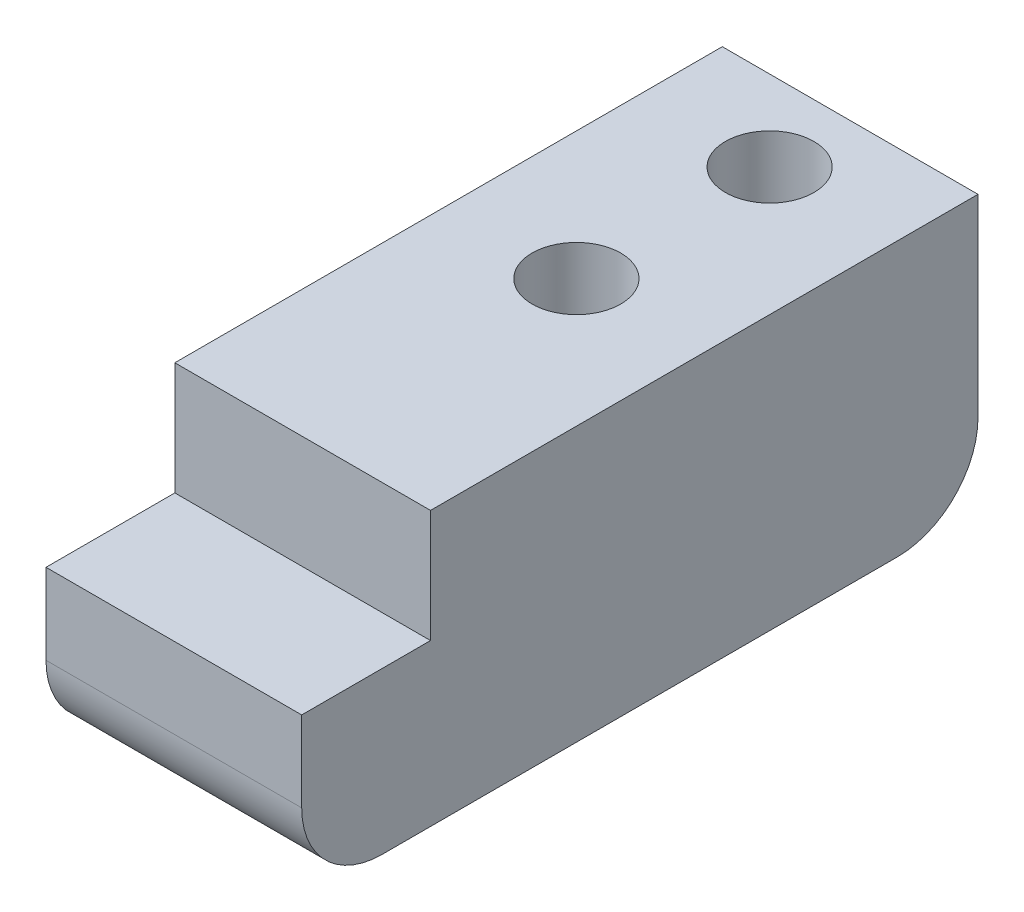
from build123d import *

# Parameters (mm, degrees)
RESSALTO_EXTRUS_O1_DEPTH            = 7.94
FILETE1_R                           = 5
ESCAREADO_PARA_SFHCS_M51_AT_2_COUNT = 2
ESCAREADO_PARA_SFHCS_M51_AT_2_PITCH = 12
ESCAREADO_PARA_SFHCS_M51_AT_3_COUNT = 2
ESCAREADO_PARA_SFHCS_M51_AT_3_PITCH = 67.209946437
ESCAREADO_PARA_SFHCS_M51_AT_4_COUNT = 2
ESCAREADO_PARA_SFHCS_M51_AT_4_PITCH = 66.13


with BuildPart() as part:
    # Esboço1 → Ressalto-extrusão1 (new, symmetric)
    with BuildSketch(Plane(origin=(0, 0, 0), x_dir=(0, 0, -1), z_dir=(1, 0, 0))):
        Polygon((-17, -8.5), (17, -8.5), (17, 8.5), (-17, 8.5), (-17, 1.5), (-25, 1.5), (-25, -8.5), align=None)
    extrude(amount=RESSALTO_EXTRUS_O1_DEPTH, both=True)

    # Filete1
    filete1_edges = [part.edges().sort_by_distance(p)[0] for p in [
        (0, -8.5, -17),
        (0, -8.5, 25),
    ]]
    fillet(filete1_edges, radius=FILETE1_R)

    # Esboço3 → Escareado para SFHCS M51 (revolve, cut)
    with BuildSketch(Plane(origin=(0, -8.5, -12), x_dir=(0, 0, -1), z_dir=(1, 0, 0))):
        Polygon((0, 0), (0, 31.652366702), (2.75, 30), (2.75, 3.35), (5.6, 0.5), (5.6, 0), align=None)
    escareado_para_sfhcs_m51 = revolve(axis=Axis((0, -14.85, -12), (0, 1, 0)), mode=Mode.SUBTRACT)

    # Escareado para SFHCS M51 at 2: Escareado para SFHCS M51 ×2
    with Locations(*[(0, 0, i * ESCAREADO_PARA_SFHCS_M51_AT_2_PITCH) for i in range(1, ESCAREADO_PARA_SFHCS_M51_AT_2_COUNT)]):
        add(escareado_para_sfhcs_m51, mode=Mode.SUBTRACT)

    # Escareado para SFHCS M51 at 3: Escareado para SFHCS M51 ×2
    with Locations(*[Vector(-0.9839317468056482, 0, 0.17854500168861018) * (i * ESCAREADO_PARA_SFHCS_M51_AT_3_PITCH) for i in range(1, ESCAREADO_PARA_SFHCS_M51_AT_3_COUNT)]):
        add(escareado_para_sfhcs_m51, mode=Mode.SUBTRACT)

    # Escareado para SFHCS M51 at 4: Escareado para SFHCS M51 ×2
    with Locations(*[(-i * ESCAREADO_PARA_SFHCS_M51_AT_4_PITCH, 0, 0) for i in range(1, ESCAREADO_PARA_SFHCS_M51_AT_4_COUNT)]):
        add(escareado_para_sfhcs_m51, mode=Mode.SUBTRACT)


solid = part.part
